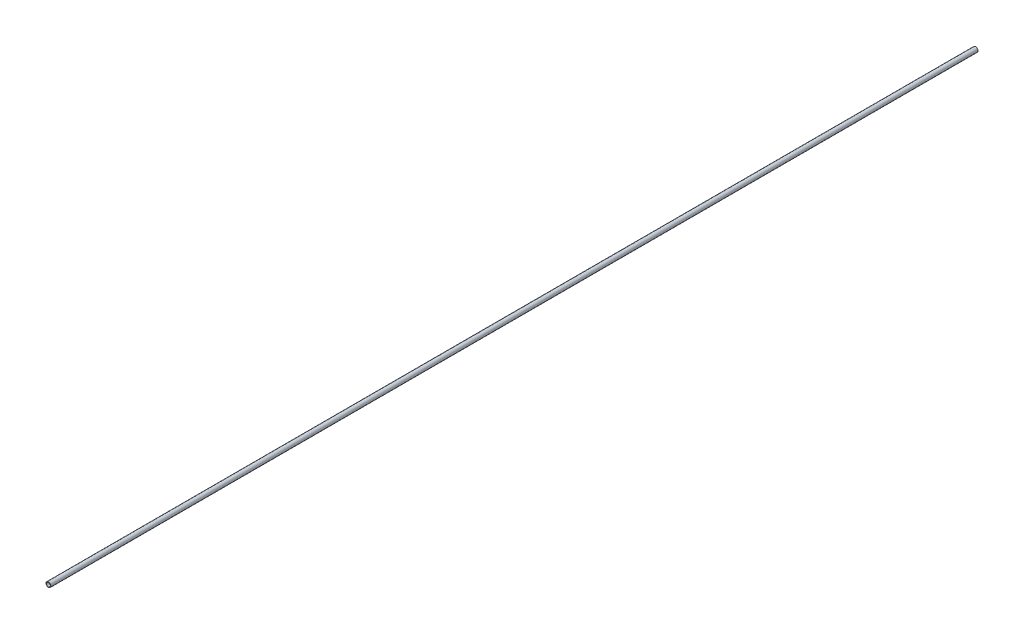
from build123d import *

# Parameters (mm, degrees)
SKETCH1_R           = 16.7005
SKETCH1_R_2         = 13.3223
BOSS_EXTRUDE1_DEPTH = 6426.2


with BuildPart() as part:
    # Sketch1 → Boss-Extrude1 (new body)
    with BuildSketch(Plane.XY):
        Circle(SKETCH1_R)
        Circle(SKETCH1_R_2, mode=Mode.SUBTRACT)
    extrude(amount=-BOSS_EXTRUDE1_DEPTH)


solid = part.part
